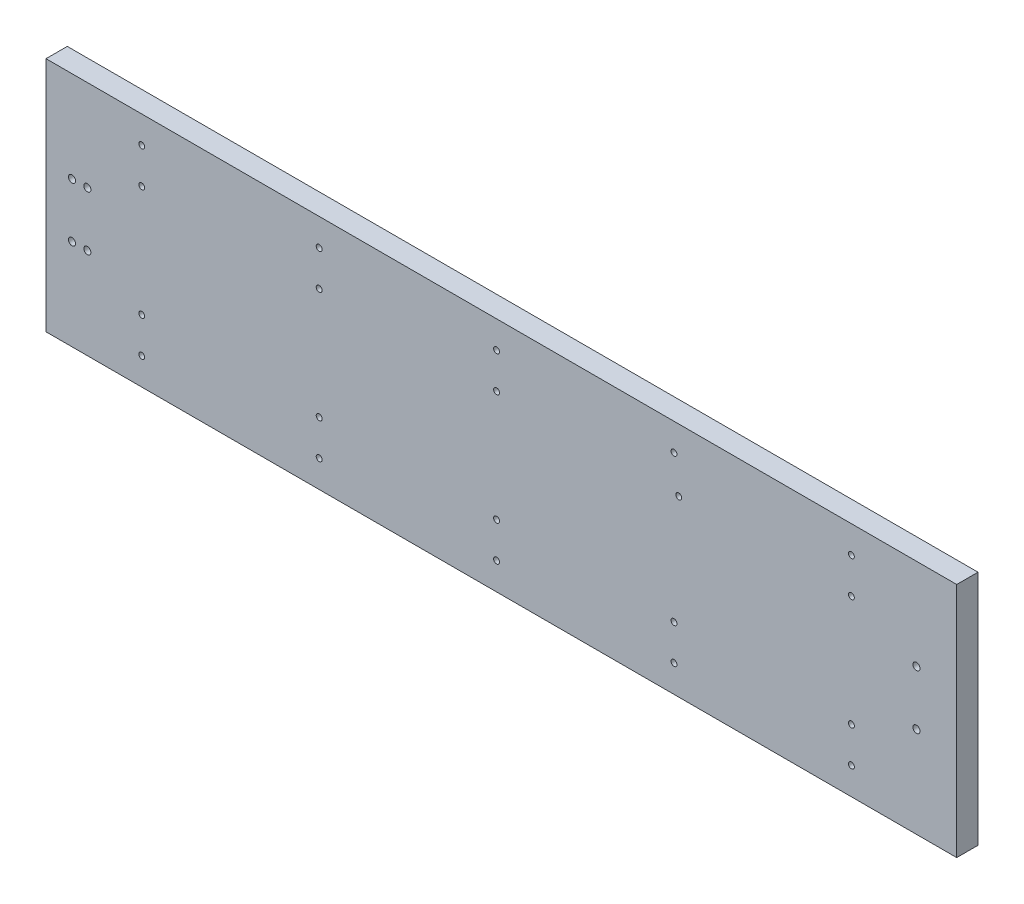
from build123d import *

# Parameters (mm, degrees)
SKETCH1_W                = 770
SKETCH1_H                = 200
BOSS_EXTRUDE1_DEPTH      = 18
F_5_0_5_DIAMETER_HOLE5_D = 5
F_6_0_6_DIAMETER_HOLE2_D = 6


with BuildPart() as part:
    # Sketch1 → Boss-Extrude1 (new body)
    with BuildSketch(Plane.XY):
        Rectangle(SKETCH1_W, SKETCH1_H)
    extrude(amount=BOSS_EXTRUDE1_DEPTH)

    # Ø5.0 (5) Diameter Hole5 (through all)
    with Locations(Plane(origin=(0, 0, 0), x_dir=(-1, 0, 0), z_dir=(0, 0, -1))):
        with Locations((-295.960122187, 77), (-295.960122187, 47), (-145.960122187, 77), (-150, 47), (4.039877813, 77), (4.039877813, 47), (154.039877813, 77), (154.039877813, 47), (304.039877813, 77), (304.039877813, 47), (304.039877813, -47), (304.039877813, -77), (154.039877813, -77), (154.039877813, -47), (4.039877813, -47), (4.039877813, -77), (-145.960122187, -77), (-145.960122187, -47), (-295.960122187, -47), (-295.960122187, -77)):
            Hole(F_5_0_5_DIAMETER_HOLE5_D / 2)

    # Ø6.0 (6) Diameter Hole2 (through all)
    with Locations(Plane(origin=(0, 0, 0), x_dir=(-1, 0, 0), z_dir=(0, 0, -1))):
        with Locations((-350.960797656, 23), (-350.960797656, -23), (350.039202344, 23), (363.039202344, 23), (350.039202344, -23), (363.039202344, -23)):
            Hole(F_6_0_6_DIAMETER_HOLE2_D / 2)


solid = part.part
